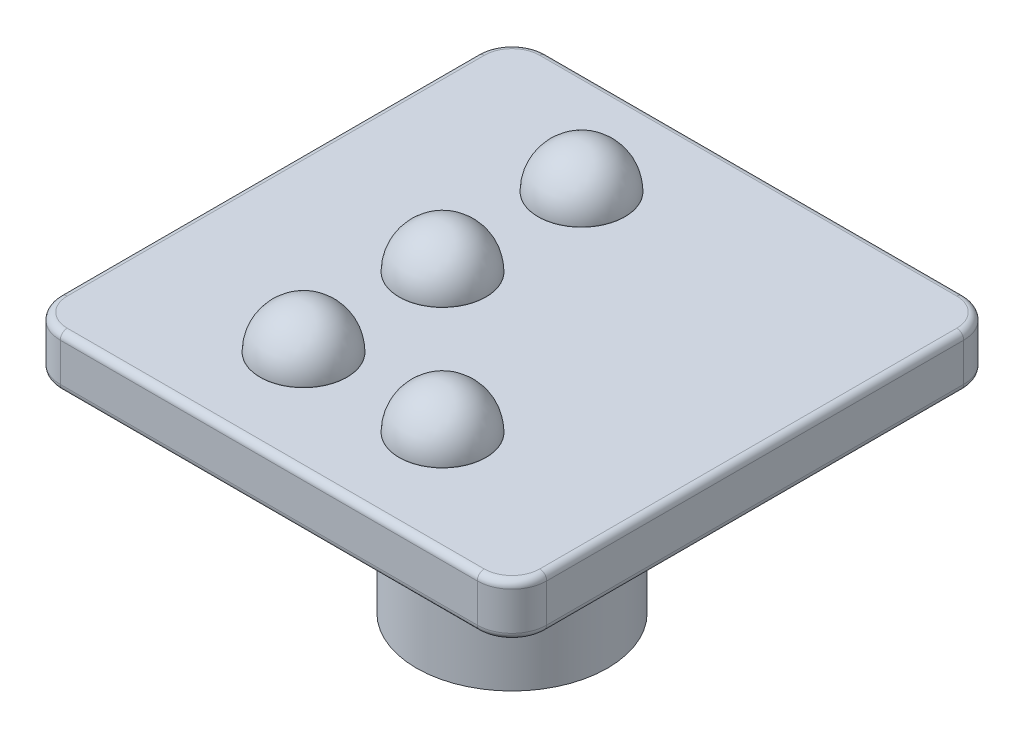
from build123d import *

# Parameters (mm, degrees)
BOSS_EXTRUDE1_DEPTH = 1.5
SKETCH2_R           = 2.75
BOSS_EXTRUDE2_DEPTH = 6
SKETCH3_W           = 1.1
SKETCH3_H           = 1.45
SKETCH3_W_2         = 1.45
SKETCH3_H_2         = 1.1
CUT_EXTRUDE1_DEPTH  = 6
CHAMFER1_SIZE       = 0.3
FILLET1_R           = 1
SKETCH4_R           = 1.25
BOSS_EXTRUDE3_DEPTH = 0.01
DOME1_FACE_RADIUS   = 1.25
DOME1_HEIGHT        = 1.25
DOME3_FACE_RADIUS   = 1.25
DOME3_HEIGHT        = 1.25
DOME5_FACE_RADIUS   = 1.25
DOME5_HEIGHT        = 1.25
DOME6_FACE_RADIUS   = 1.25
DOME6_HEIGHT        = 1.25
FILLET3_R           = 0.2


with BuildPart() as part:
    # Sketch1 → Boss-Extrude1 (new body)
    with BuildSketch(Plane(origin=(0, 0, 0), x_dir=(1, 0, 0), z_dir=(0, 1, 0))):
        with BuildLine():
            Line((-7.324675649, 4.396717546), (4.675324351, 4.396717546))
            ThreePointArc((4.675324351, 4.396717546), (5.382431132, 4.103824327), (5.675324351, 3.396717546))
            Line((5.675324351, 3.396717546), (5.675324351, -8.603282454))
            ThreePointArc((5.675324351, -8.603282454), (5.382431132, -9.310389235), (4.675324351, -9.603282454))
            Line((4.675324351, -9.603282454), (-7.324675649, -9.603282454))
            ThreePointArc((-7.324675649, -9.603282454), (-8.03178243, -9.310389235), (-8.324675649, -8.603282454))
            Line((-8.324675649, -8.603282454), (-8.324675649, 3.396717546))
            ThreePointArc((-8.324675649, 3.396717546), (-8.03178243, 4.103824327), (-7.324675649, 4.396717546))
        make_face()
    extrude(amount=BOSS_EXTRUDE1_DEPTH)

    # Sketch2 → Boss-Extrude2 (add)
    with BuildSketch(Plane.XZ):
        with Locations(Location((-1.324675649, 2.603282454, 0), (0, 0, 270))):
            Circle(SKETCH2_R)
    extrude(amount=BOSS_EXTRUDE2_DEPTH)

    # Sketch3 → Cut-Extrude1 (cut)
    with BuildSketch(Plane.XZ.offset(6)):
        with Locations((-1.324675649, 3.878282454)):
            Rectangle(SKETCH3_W, SKETCH3_H)
        with Locations((-0.049675649, 2.603282454)):
            Rectangle(SKETCH3_W_2, SKETCH3_H_2)
        with Locations((-1.324675649, 2.603282454)):
            Rectangle(SKETCH3_W, SKETCH3_H_2)
        with Locations((-2.599675649, 2.603282454)):
            Rectangle(SKETCH3_W_2, SKETCH3_H_2)
        with Locations((-1.324675649, 1.328282454)):
            Rectangle(SKETCH3_W, SKETCH3_H)
    extrude(amount=-CUT_EXTRUDE1_DEPTH, mode=Mode.SUBTRACT)

    # Chamfer1
    chamfer1_edges = [part.edges().sort_by_distance(p)[0] for p in [
        (-0.774675649, -6, 3.878282454),
        (-0.049675649, -6, 3.153282454),
        (0.675324351, -6, 2.603282454),
        (-0.774675649, -6, 1.328282454),
        (-2.599675649, -6, 3.153282454),
        (-1.324675649, -6, 4.603282454),
        (-1.874675649, -6, 3.878282454),
        (-3.324675649, -6, 2.603282454),
        (-2.599675649, -6, 2.053282454),
        (-1.874675649, -6, 1.328282454),
        (-1.324675649, -6, 0.603282454),
        (-0.049675649, -6, 2.053282454),
    ]]
    chamfer(chamfer1_edges, length=CHAMFER1_SIZE)

    # Fillet1
    fillet1_edges = [part.edges().sort_by_distance(p)[0] for p in [
        (-1.324675649, 0, 5.353282454),
    ]]
    fillet(fillet1_edges, radius=FILLET1_R)

    # Sketch4 → Boss-Extrude3 (add)
    with BuildSketch(Plane(origin=(0, 1.5, 0), x_dir=(1, 0, 0), z_dir=(0, 1, 0))):
        with Locations(Location((-3.324675649, 1.396717546, 0), (0, 0, 90))):
            Circle(SKETCH4_R)
        with Locations(Location((-3.324675649, -2.603282454, 0), (0, 0, 90))):
            Circle(SKETCH4_R)
        with Locations(Location((-3.324675649, -6.603282454, 0), (0, 0, 90))):
            Circle(SKETCH4_R)
        with Locations(Location((0.675324351, -6.603282454, 0), (0, 0, 90))):
            Circle(SKETCH4_R)
    extrude(amount=BOSS_EXTRUDE3_DEPTH)

    # Dome1: a dome of height H over a round flat face of radius A is a cap of a sphere of radius (A * A + H * H) / (2 * H)
    dome1_r = (DOME1_FACE_RADIUS * DOME1_FACE_RADIUS + DOME1_HEIGHT * DOME1_HEIGHT) / (2 * DOME1_HEIGHT)
    dome1_base = Plane((-3.324675649, 1.51, -1.396717546), z_dir=(0, 1, 0))
    with Locations(dome1_base.offset(DOME1_HEIGHT - dome1_r)):
        dome1_ball = Sphere(dome1_r, mode=Mode.PRIVATE)
    add(split(dome1_ball, bisect_by=dome1_base, keep=Keep.TOP, mode=Mode.PRIVATE))

    # Dome3: a dome of height H over a round flat face of radius A is a cap of a sphere of radius (A * A + H * H) / (2 * H)
    dome3_r = (DOME3_FACE_RADIUS * DOME3_FACE_RADIUS + DOME3_HEIGHT * DOME3_HEIGHT) / (2 * DOME3_HEIGHT)
    dome3_base = Plane((-3.324675649, 1.51, 2.603282454), z_dir=(0, 1, 0))
    with Locations(dome3_base.offset(DOME3_HEIGHT - dome3_r)):
        dome3_ball = Sphere(dome3_r, mode=Mode.PRIVATE)
    add(split(dome3_ball, bisect_by=dome3_base, keep=Keep.TOP, mode=Mode.PRIVATE))

    # Dome5: a dome of height H over a round flat face of radius A is a cap of a sphere of radius (A * A + H * H) / (2 * H)
    dome5_r = (DOME5_FACE_RADIUS * DOME5_FACE_RADIUS + DOME5_HEIGHT * DOME5_HEIGHT) / (2 * DOME5_HEIGHT)
    dome5_base = Plane((-3.324675649, 1.51, 6.603282454), z_dir=(0, 1, 0))
    with Locations(dome5_base.offset(DOME5_HEIGHT - dome5_r)):
        dome5_ball = Sphere(dome5_r, mode=Mode.PRIVATE)
    add(split(dome5_ball, bisect_by=dome5_base, keep=Keep.TOP, mode=Mode.PRIVATE))

    # Dome6: a dome of height H over a round flat face of radius A is a cap of a sphere of radius (A * A + H * H) / (2 * H)
    dome6_r = (DOME6_FACE_RADIUS * DOME6_FACE_RADIUS + DOME6_HEIGHT * DOME6_HEIGHT) / (2 * DOME6_HEIGHT)
    dome6_base = Plane((0.675324351, 1.51, 6.603282454), z_dir=(0, 1, 0))
    with Locations(dome6_base.offset(DOME6_HEIGHT - dome6_r)):
        dome6_ball = Sphere(dome6_r, mode=Mode.PRIVATE)
    add(split(dome6_ball, bisect_by=dome6_base, keep=Keep.TOP, mode=Mode.PRIVATE))

    # Fillet3
    fillet3_edges = [part.edges().sort_by_distance(p)[0] for p in [
        (5.382431132, 1.5, 9.310389235),
        (-1.324675649, 0, 9.603282454),
        (-8.03178243, 0, 9.310389235),
        (5.675324351, 1.5, 2.603282454),
        (5.382431132, 1.5, -4.103824327),
        (-1.324675649, 1.5, -4.396717546),
        (-8.03178243, 1.5, -4.103824327),
        (-8.324675649, 1.5, 2.603282454),
        (-8.03178243, 1.5, 9.310389235),
        (-1.324675649, 1.5, 9.603282454),
        (-8.324675649, 0, 2.603282454),
        (-8.03178243, 0, -4.103824327),
        (-1.324675649, 0, -4.396717546),
        (5.382431132, 0, -4.103824327),
        (5.675324351, 0, 2.603282454),
        (5.382431132, 0, 9.310389235),
    ]]
    fillet(fillet3_edges, radius=FILLET3_R)


solid = part.part
